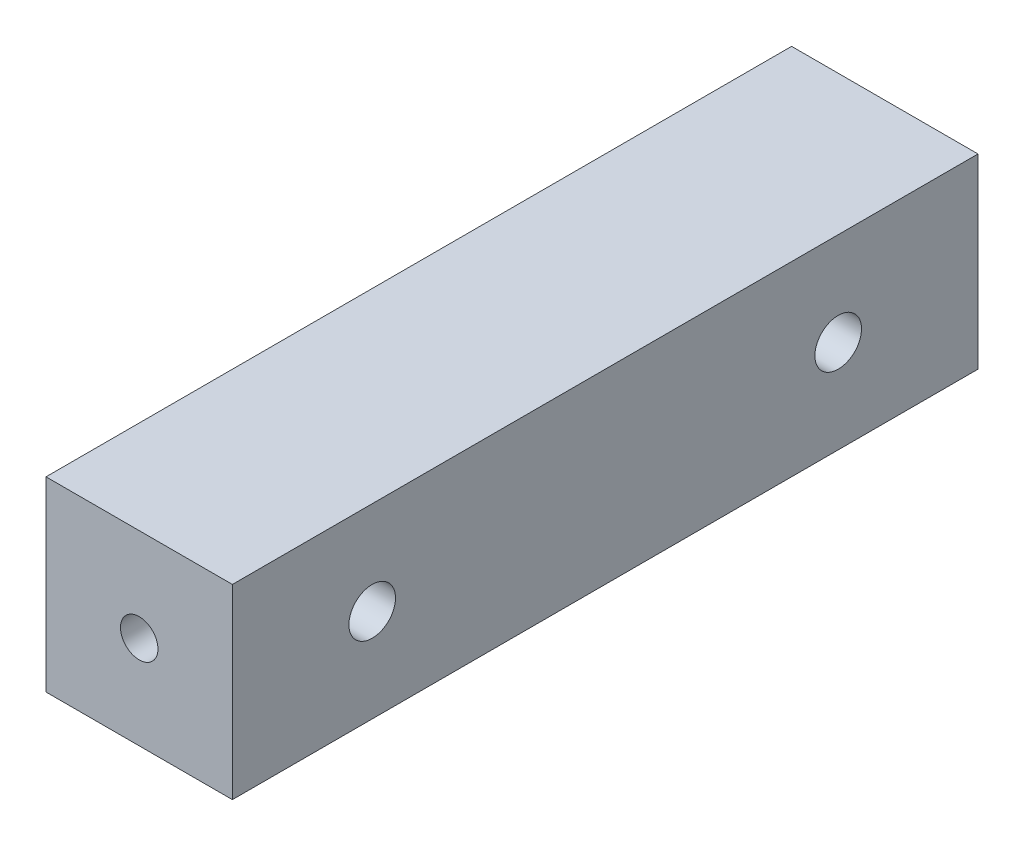
from build123d import *

# Parameters (mm, degrees)
SKETCH1_W           = 25.4
SKETCH1_H           = 25.4
BOSS_EXTRUDE1_DEPTH = 50.8
SKETCH2_R           = 2.5527
CUT_EXTRUDE1_DEPTH  = 12.7
CUT_EXTRUDE2_START  = -12.7
SKETCH3_R           = 2.5527
CUT_EXTRUDE2_DEPTH  = 12.7
SKETCH4_R           = 3.175
CUT_EXTRUDE3_DEPTH  = 59.198711326


with BuildPart() as part:
    # Sketch1 → Boss-Extrude1 (new, symmetric)
    with BuildSketch(Plane.XY):
        Rectangle(SKETCH1_W, SKETCH1_H)
    extrude(amount=BOSS_EXTRUDE1_DEPTH, both=True)

    # Sketch2 → Cut-Extrude1 (cut)
    with BuildSketch(Plane.XY.offset(50.8)):
        Circle(SKETCH2_R)
    extrude(amount=-CUT_EXTRUDE1_DEPTH, mode=Mode.SUBTRACT)

    # Sketch3 → Cut-Extrude2 (cut)
    with BuildSketch(Plane(origin=(0, 0, -50.8), x_dir=(-1, 0, 0), z_dir=(0, 0, -1)).offset(CUT_EXTRUDE2_START)):
        with Locations(Location((0, 0, 0), (0, 0, 180))):
            Circle(SKETCH3_R)
    extrude(amount=CUT_EXTRUDE2_DEPTH, mode=Mode.SUBTRACT)

    # Sketch4 → Cut-Extrude3 (cut, through all)
    with BuildSketch(Plane(origin=(12.7, 0, 0), x_dir=(0, 0, -1), z_dir=(1, 0, 0))):
        with Locations((-31.75, 0)):
            Circle(SKETCH4_R)
        with Locations((31.75, 0)):
            Circle(SKETCH4_R)
    extrude(amount=-CUT_EXTRUDE3_DEPTH, mode=Mode.SUBTRACT)


solid = part.part
